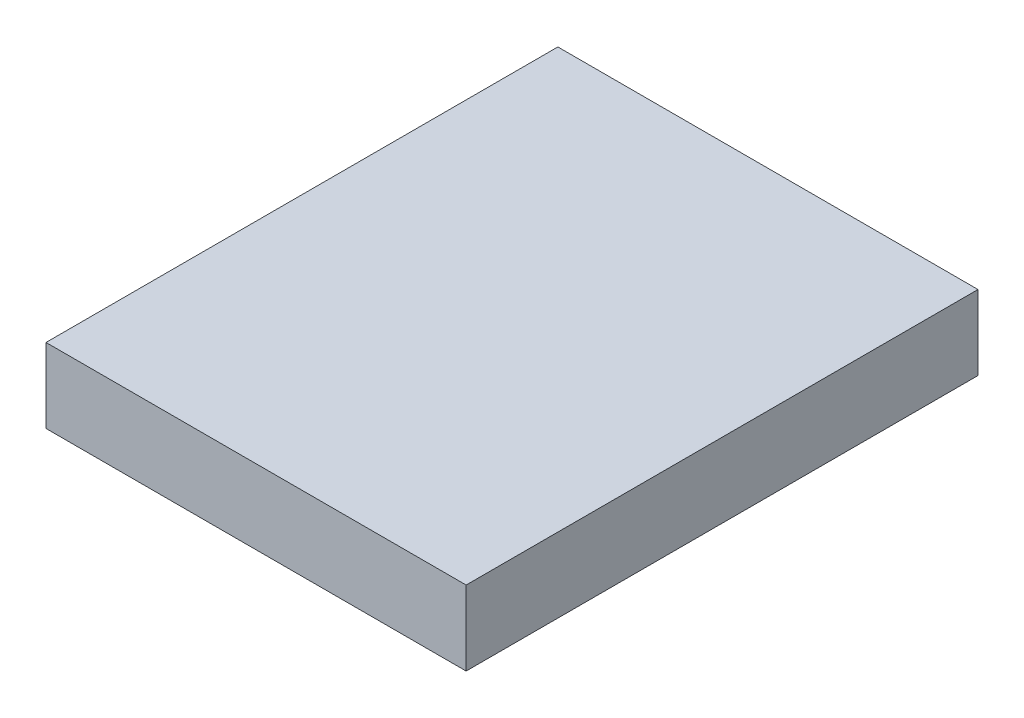
from build123d import *

# Parameters (mm, degrees)
ESQUISSE1_W        = 366.46
ESQUISSE1_H        = 65
BOSS_EXTRU_2_DEPTH = 446.46


with BuildPart() as part:
    # Esquisse1 → Boss.-Extru.2 (new body)
    with BuildSketch(Plane.XY):
        with Locations((183.23, 32.5)):
            Rectangle(ESQUISSE1_W, ESQUISSE1_H)
    extrude(amount=BOSS_EXTRU_2_DEPTH)


solid = part.part
